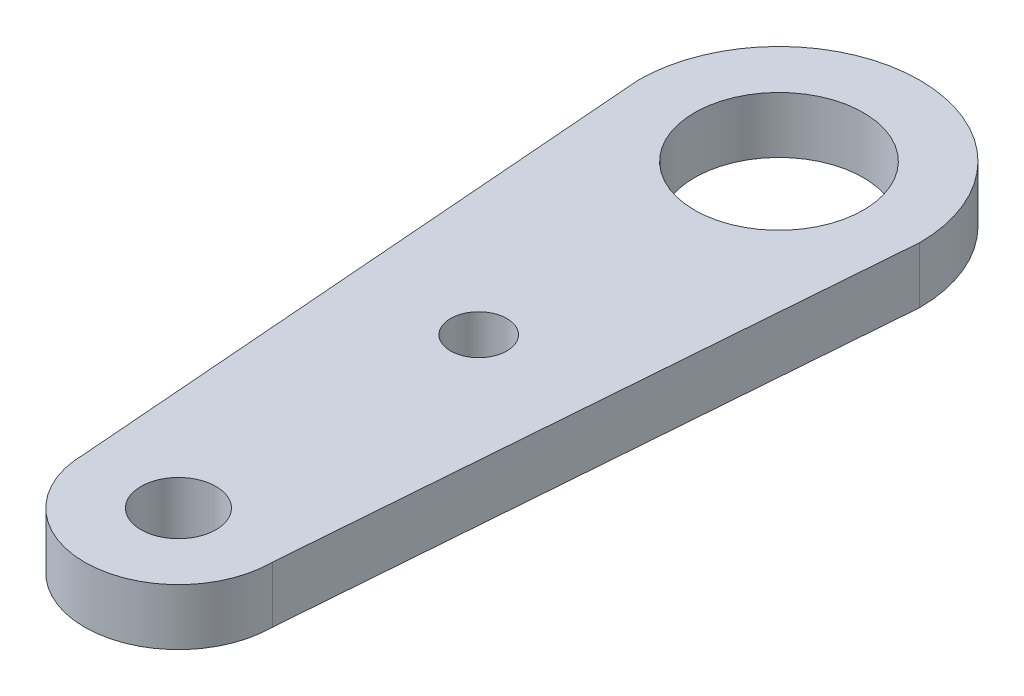
from build123d import *

# Parameters (mm, degrees)
SKETCH_1_R          = 4.5
SKETCH_1_R_2        = 5
SKETCH_1_R_3        = 2
EXTRUDE_1_DEPTH     = 3
SKETCH_2_R          = 1.5
CUT_EXTRUDE_1_DEPTH = 41.317490001


with BuildPart() as part:
    # 草图1 → 凸台-拉伸1 (new body)
    # profile 1 of 3: a face of its own
    with BuildSketch(Plane(origin=(0, 0, 0), x_dir=(1, 0, 0), z_dir=(0, 1, 0))):
        with BuildLine():
            ThreePointArc((7.5, 32), (0, 39.5), (-7.5, 32))
            Line((-7.5, 32), (-7.409002669, 30.835234166))
            ThreePointArc((-7.409002669, 30.835234166), (0, 24.5), (7.409002669, 30.835234166))
            Line((7.409002669, 30.835234166), (7.5, 32))
        make_face()
        with Locations(Location((0, 32, 0), (0, 0, 270))):
            Circle(SKETCH_1_R, mode=Mode.SUBTRACT)
    # profile 2 of 3: a face of its own
    with BuildSketch(Plane(origin=(0, 0, 0), x_dir=(1, 0, 0), z_dir=(0, 1, 0))):
        Circle(SKETCH_1_R_2)
        with Locations(Location((0, 0, 0), (0, 0, 270))):
            Circle(SKETCH_1_R_3, mode=Mode.SUBTRACT)
    # profile 3 of 3: a face of its own
    with BuildSketch(Plane(origin=(0, 0, 0), x_dir=(1, 0, 0), z_dir=(0, 1, 0))):
        with BuildLine():
            ThreePointArc((7.409002669, 30.835234166), (0, 24.5), (-7.409002669, 30.835234166))
            Line((-7.409002669, 30.835234166), (-5, 0))
            ThreePointArc((-5, 0), (0, 5), (5, 0))
            Line((5, 0), (7.409002669, 30.835234166))
        make_face()
    extrude(amount=EXTRUDE_1_DEPTH)

    # 草图2 → 切除-拉伸1 (cut, through all)
    with BuildSketch(Plane(origin=(0, 3, 0), x_dir=(1, 0, 0), z_dir=(0, 1, 0))):
        with Locations(Location((0, 16, 0), (0, 0, 270))):
            Circle(SKETCH_2_R)
    extrude(amount=-CUT_EXTRUDE_1_DEPTH, mode=Mode.SUBTRACT)


solid = part.part
